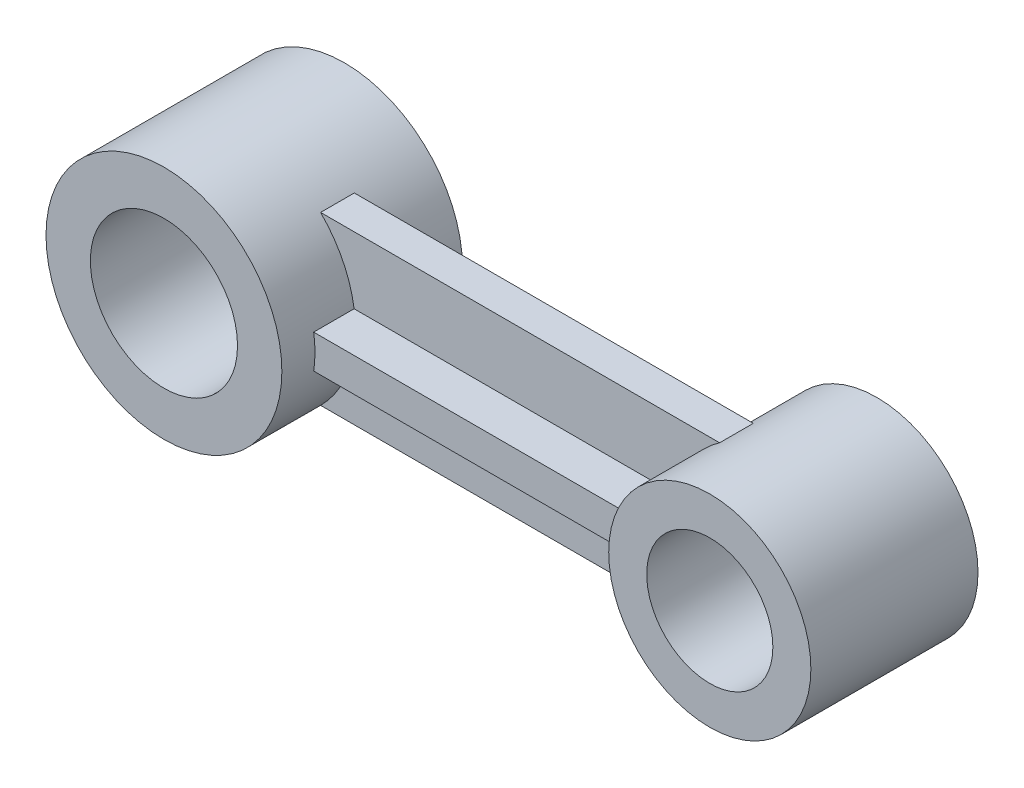
from build123d import *

# Parameters (mm, degrees)
SKETCH1_R           = 13.8684
BOSS_EXTRUDE1_DEPTH = 17.018
SKETCH1_3_R         = 11.8872
BOSS_EXTRUDE2_DEPTH = 15.748
BOSS_EXTRUDE3_DEPTH = 3.175
SKETCH3_W           = 68.65982448
SKETCH3_H           = 6.35
BOSS_EXTRUDE5_DEPTH = 10.795


with BuildPart() as part:
    # Sketch1 → Boss-Extrude1 (new, symmetric)
    with BuildSketch(Plane.XY):
        with BuildLine():
            ThreePointArc((-28.575, 0), (-30.275606021, 8.526422275), (-35.117171142, 15.748))
            ThreePointArc((-35.117171142, 15.748), (-73.025, 0), (-35.117171142, -15.748))
            ThreePointArc((-35.117171142, -15.748), (-30.275606021, -8.526422275), (-28.575, 0))
        make_face()
        with Locations((-50.8, 0)):
            Circle(SKETCH1_R, mode=Mode.SUBTRACT)
    extrude(amount=BOSS_EXTRUDE1_DEPTH, both=True)



with BuildPart() as body_2:
    # Sketch1<3> → Boss-Extrude2 (new, symmetric)
    with BuildSketch(Plane.XY):
        with BuildLine():
            ThreePointArc((69.85, 0), (59.707866953, 16.839014411), (40.080718494, 15.748))
            ThreePointArc((40.080718494, 15.748), (31.75, 0), (40.080718494, -15.748))
            ThreePointArc((40.080718494, -15.748), (59.707866953, -16.839014411), (69.85, 0))
        make_face()
        with Locations((50.8, 0)):
            Circle(SKETCH1_3_R, mode=Mode.SUBTRACT)
    extrude(amount=BOSS_EXTRUDE2_DEPTH, both=True)


with BuildPart() as part_1:
    add(part.part)

    add(body_2.part)  # Boss-Extrude3 merges body 2
    # Sketch1<4> → Boss-Extrude3 (add, symmetric)
    with BuildSketch(Plane.XY):
        with BuildLine():
            Line((40.080718494, 15.748), (-35.117171142, 15.748))
            ThreePointArc((-35.117171142, 15.748), (-30.275606021, 8.526422275), (-28.575, 0))
            ThreePointArc((-28.575, 0), (-30.275606021, -8.526422275), (-35.117171142, -15.748))
            Line((-35.117171142, -15.748), (40.080718494, -15.748))
            ThreePointArc((40.080718494, -15.748), (31.75, 0), (40.080718494, 15.748))
        make_face()
    extrude(amount=BOSS_EXTRUDE3_DEPTH, both=True)

    # Sketch3 → Boss-Extrude5 (add, symmetric)
    with BuildSketch(Plane.XY):
        Rectangle(SKETCH3_W, SKETCH3_H)
    extrude(amount=BOSS_EXTRUDE5_DEPTH, both=True)


solid = part_1.part
